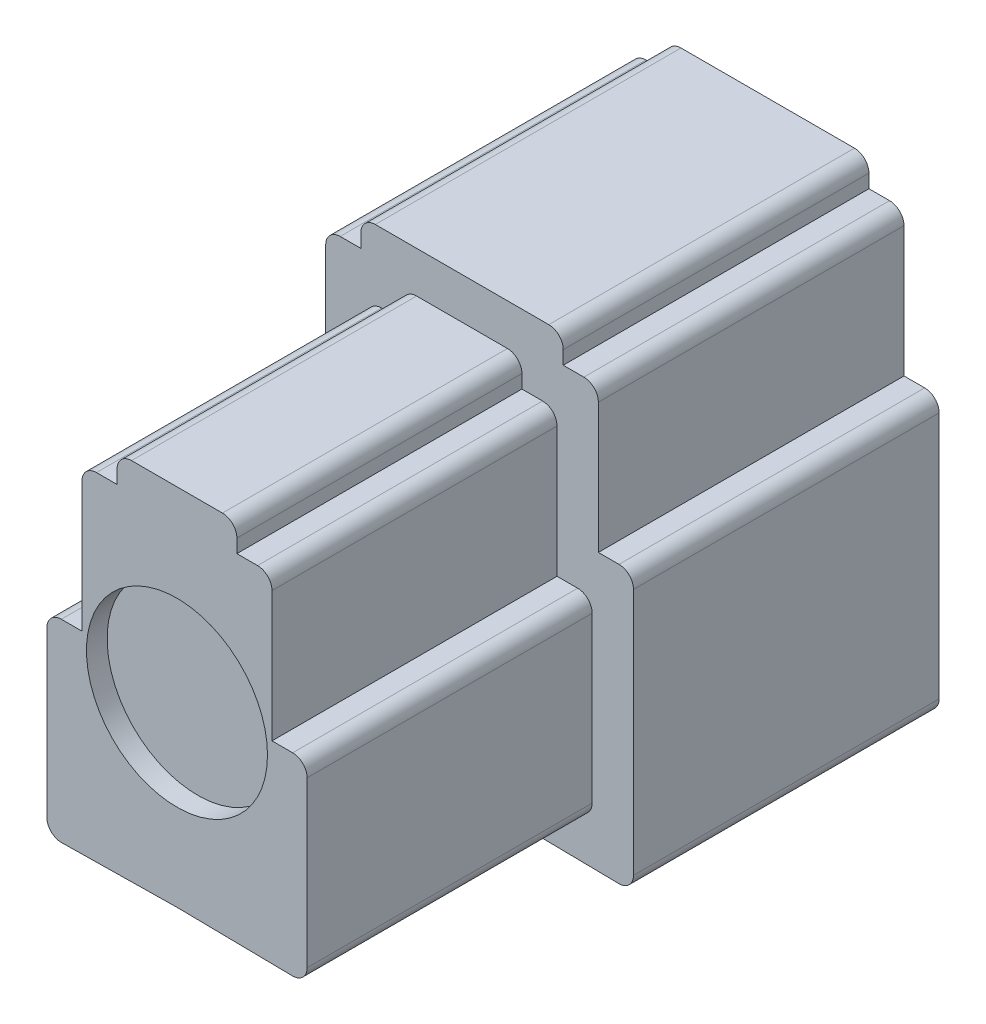
from build123d import *

# Parameters (mm, degrees)
EXTRUDE_1_DEPTH     = 14.8
EXTRUDE_2_DEPTH     = 13.8
CUT_EXTRUDE_1_DEPTH = 12
FILLET_1_R          = 0.7
SKETCH_4_R          = 4.382397862
CUT_EXTRUDE_2_DEPTH = 1


with BuildPart() as part:
    # ｽｹｯﾁ1 → ﾎﾞｽ - 押し出し1 (new body)
    with BuildSketch(Plane.XY):
        Polygon((0, 0), (8.3, -0.120571415), (8.3, 13.279428585), (6.6, 13.279428585), (6.6, 20.279428585), (4.9, 20.279428585), (4.9, 21.63120639), (-4.9, 21.63120639), (-4.9, 20.279428585), (-6.6, 20.279428585), (-6.6, 13.279428585), (-8.3, 13.279428585), (-8.3, -0.120571415), align=None)
    extrude(amount=EXTRUDE_1_DEPTH)

    # ｽｹｯﾁ2 → ﾎﾞｽ - 押し出し2 (add)
    with BuildSketch(Plane.XY.offset(14.8)):
        Polygon((-6.3, 1.908692951), (0, 2.000211013), (6.3, 1.908692951), (6.3, 11.279428585), (4.6, 11.279428585), (4.6, 18.279428585), (2.9, 18.279428585), (2.9, 19.63120639), (-2.9, 19.63120639), (-2.9, 18.279428585), (-4.6, 18.279428585), (-4.6, 11.279428585), (-6.3, 11.279428585), align=None)
    extrude(amount=EXTRUDE_2_DEPTH)

    # ｽｹｯﾁ3 → ｶｯﾄ - 押し出し1 (cut)
    with BuildSketch(Plane(origin=(0, 0, 0), x_dir=(-1, 0, 0), z_dir=(0, 0, -1))):
        Polygon((0, 1.000105507), (7.3, 0.894060768), (7.3, 12.279428585), (5.6, 12.279428585), (5.6, 19.279428585), (3.9, 19.279428585), (3.9, 20.63120639), (-3.9, 20.63120639), (-3.9, 19.279428585), (-5.6, 19.279428585), (-5.6, 12.279428585), (-7.3, 12.279428585), (-7.3, 0.894060768), align=None)
    extrude(amount=-CUT_EXTRUDE_1_DEPTH, mode=Mode.SUBTRACT)

    # ﾌｨﾚｯﾄ1
    fillet_1_edges = [part.edges().sort_by_distance(p)[0] for p in [
        (-8.3, 13.279428585, 7.4),
        (-6.6, 20.279428585, 7.4),
        (-4.9, 21.63120639, 7.4),
        (4.9, 21.63120639, 7.4),
        (6.6, 20.279428585, 7.4),
        (8.3, 13.279428585, 7.4),
        (8.3, -0.120571415, 7.4),
        (-6.3, 11.279428585, 21.7),
        (-6.3, 1.908692951, 21.7),
        (6.3, 1.908692951, 21.7),
        (6.3, 11.279428585, 21.7),
        (4.6, 18.279428585, 21.7),
        (2.9, 19.63120639, 21.7),
        (-2.9, 19.63120639, 21.7),
        (-4.6, 18.279428585, 21.7),
    ]]
    fillet(fillet_1_edges, radius=FILLET_1_R)

    # ｽｹｯﾁ4 → ｶｯﾄ - 押し出し2 (cut)
    with BuildSketch(Plane.XY.offset(28.6)):
        with Locations((0, 10.579428585)):
            Circle(SKETCH_4_R)
    extrude(amount=-CUT_EXTRUDE_2_DEPTH, mode=Mode.SUBTRACT)


solid = part.part
